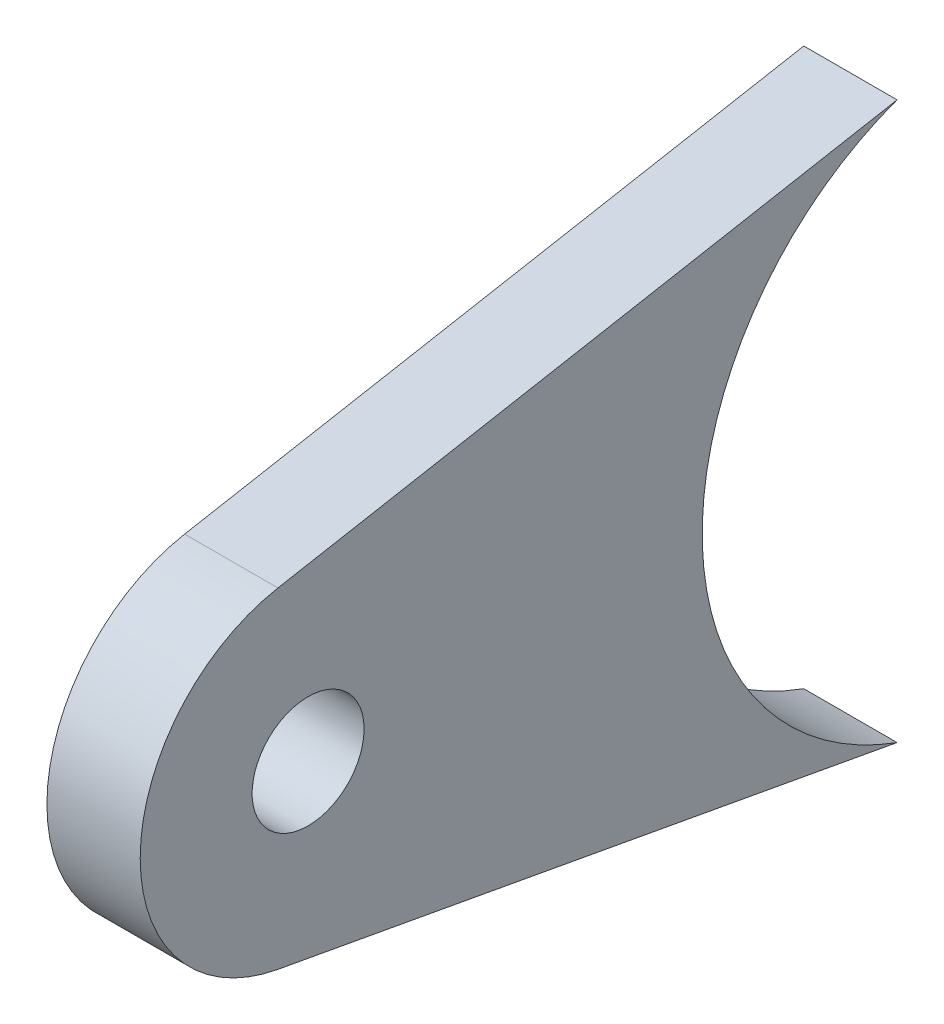
from build123d import *

# Parameters (mm, degrees)
SKETCH1_R           = 3
BOSS_EXTRUDE1_DEPTH = 2.5


with BuildPart() as part:
    # Sketch1 → Boss-Extrude1 (new, symmetric)
    with BuildSketch(Plane.YZ):
        with BuildLine():
            Line((-14.917620355, 5.429569775), (-8.85341753, 38.617713829))
            ThreePointArc((-8.85341753, 38.617713829), (0, 46), (8.85341753, 38.617713829))
            Line((8.85341753, 38.617713829), (14.917620355, 5.429569775))
            ThreePointArc((14.917620355, 5.429569775), (0, 15.875), (-14.917620355, 5.429569775))
        make_face()
        with Locations(Location((0, 37, 0), (0, 0, 270))):
            Circle(SKETCH1_R, mode=Mode.SUBTRACT)
    extrude(amount=BOSS_EXTRUDE1_DEPTH, both=True)


solid = part.part
